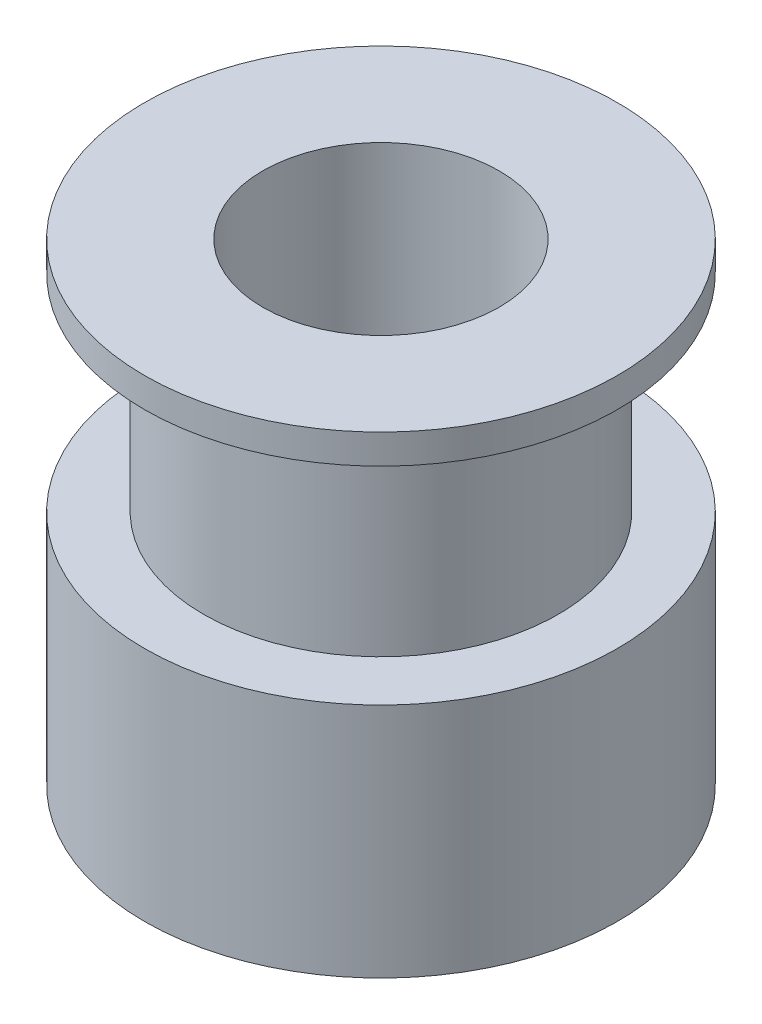
from build123d import *

# Parameters (mm, degrees)
SKETCH_2_R          = 4
CUT_EXTRUDE_1_DEPTH = 20.595917942


with BuildPart() as part:
    # 草图1 → 旋转1 (revolve)
    with BuildSketch(Plane.XY, mode=Mode.PRIVATE) as revolve_1_sk:
        Polygon((0, 14.15), (-8, 14.15), (-8, 13.15), (-6, 13.15), (-6, 6.15), (-8, 6.15), (-8, -1.85), (0, -1.85), align=None)
    revolve(revolve_1_sk.sketch.rotate(Axis((0, 15.9, 0), (0, -1, 0)), 270), axis=Axis((0, 15.9, 0), (0, -1, 0)))

    # 草图2 → 切除-拉伸1 (cut, through all)
    with BuildSketch(Plane.XZ.offset(1.85)):
        with Locations(Location((0, 0, 0), (0, 0, 270))):
            Circle(SKETCH_2_R)
    extrude(amount=-CUT_EXTRUDE_1_DEPTH, mode=Mode.SUBTRACT)


solid = part.part
